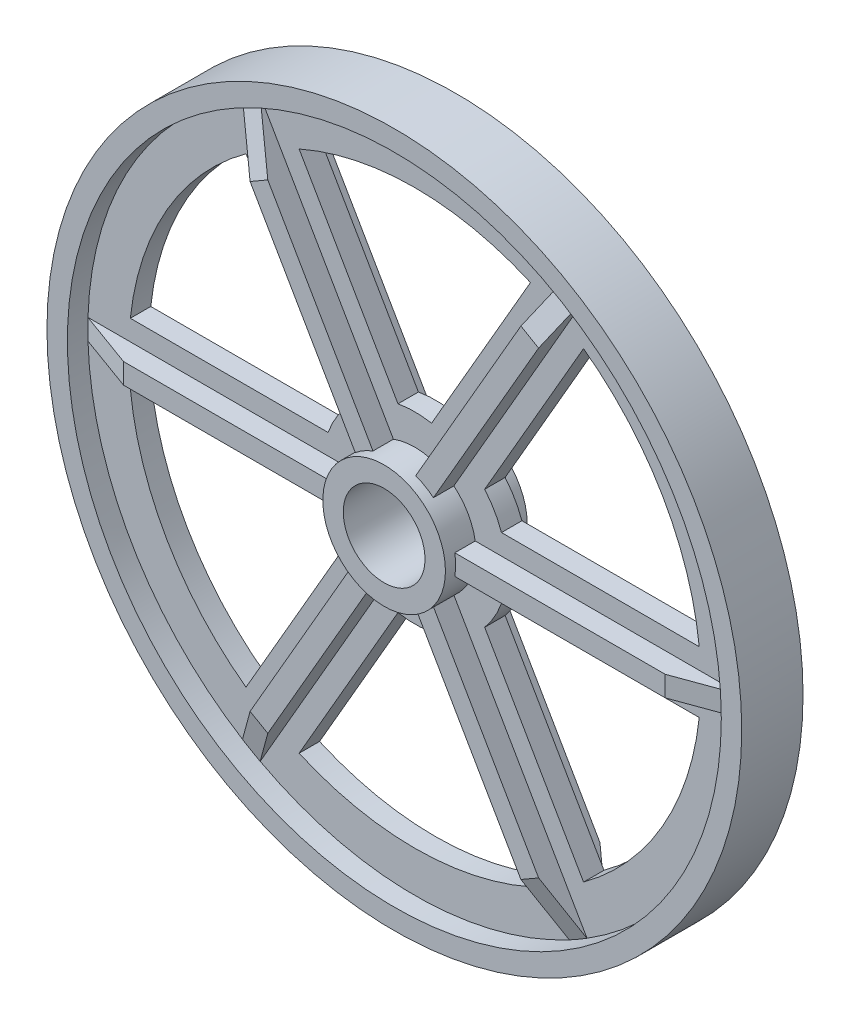
from build123d import *

# Parameters (mm, degrees)
SKETCH1_R           = 15
BOSS_EXTRUDE1_DEPTH = 10
BOSS_EXTRUDE9_DEPTH = 2.5
CIRPATTERN1_COUNT   = 6
CUT_EXTRUDE2_DEPTH  = 5
CIRPATTERN2_COUNT   = 6
SKETCH3_R           = 10
CUT_EXTRUDE3_DEPTH  = 25


with BuildPart() as part:
    # Sketch1 → Boss-Extrude1 (new, symmetric)
    with BuildSketch(Plane.XY):
        Circle(SKETCH1_R)
    extrude(amount=BOSS_EXTRUDE1_DEPTH, both=True)

    # Sketch2 → Revolve1 (revolve)
    with BuildSketch(Plane(origin=(0, 0, 0), x_dir=(0, 0, -1), z_dir=(1, 0, 0)), mode=Mode.PRIVATE) as revolve1_sk:
        Polygon((-2.5, 15), (-2.5, 80), (-7.5, 80), (-7.5, 85), (7.5, 85), (7.5, 80), (2.5, 80), (2.5, 15), align=None)
    revolve(revolve1_sk.sketch.rotate(Axis((0, 0, 0), (0, 0, -1)), 90), axis=Axis((0, 0, 0), (0, 0, -1)))

    # Sketch5 → Boss-Extrude9 (add, symmetric)
    with BuildSketch(Plane(origin=(0, 0, 0), x_dir=(1, 0, 0), z_dir=(0, 1, 0))):
        Polygon((0, -2.5), (-80, -2.5), (-66.262612903, -7.5), (0, -7.5), align=None)
        Polygon((0, 7.5), (-66.262612903, 7.5), (-80, 2.5), (0, 2.5), align=None)
    boss_extrude9 = extrude(amount=BOSS_EXTRUDE9_DEPTH, both=True)

    # CirPattern1: Boss-Extrude9 ×6 about axis
    cirpattern1_axis = Axis((0, 0, 0), (0, 0, 1))
    for i in range(1, CIRPATTERN1_COUNT):
        add(boss_extrude9.rotate(cirpattern1_axis, i * 360 / CIRPATTERN1_COUNT))

    # Sketch6 → Cut-Extrude2 (cut)
    with BuildSketch(Plane.XY.offset(2.5)):
        with BuildLine():
            Line((-17.101792246, 14.621173071), (-41.293717796, 56.522817256))
            ThreePointArc((-41.293717796, 56.522817256), (-60.621778265, 35), (-69.597054535, 7.5))
            Line((-69.597054535, 7.5), (-21.213203436, 7.5))
            ThreePointArc((-21.213203436, 7.5), (-19.485571585, 11.25), (-17.101792246, 14.621173071))
        make_face()
    cut_extrude2 = extrude(amount=-CUT_EXTRUDE2_DEPTH, mode=Mode.SUBTRACT)

    # CirPattern2: Cut-Extrude2 ×6 about axis
    cirpattern2_axis = Axis((0, 0, 0), (0, 0, 1))
    for i in range(1, CIRPATTERN2_COUNT):
        add(cut_extrude2.rotate(cirpattern2_axis, i * 360 / CIRPATTERN2_COUNT), mode=Mode.SUBTRACT)

    # Sketch3 → Cut-Extrude3 (cut)
    with BuildSketch(Plane.XY.offset(10)):
        Circle(SKETCH3_R)
    extrude(amount=-CUT_EXTRUDE3_DEPTH, mode=Mode.SUBTRACT)


solid = part.part
